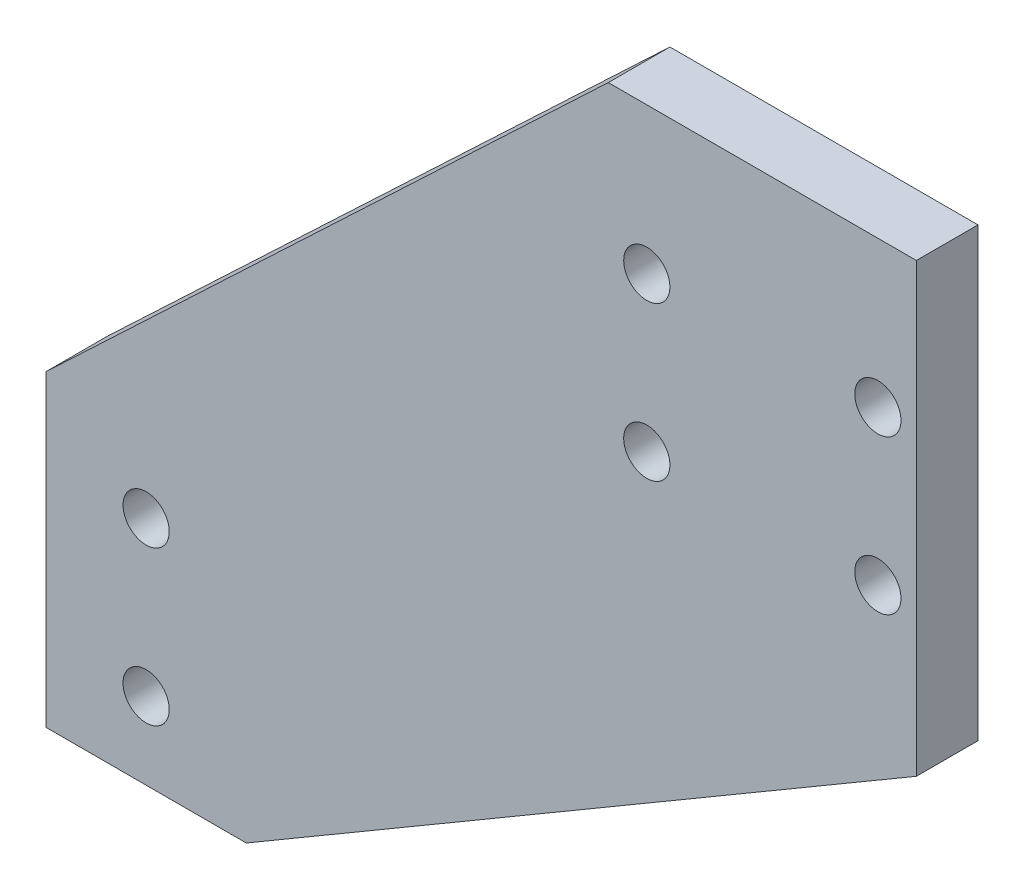
from build123d import *

# Parameters (mm, degrees)
SKETCH_1_R      = 1.5
EXTRUDE_1_DEPTH = 4


with BuildPart() as part:
    # 草图1 → 凸台-拉伸1 (new body)
    with BuildSketch(Plane.XY):
        Polygon((0, 0), (13, 0), (56.5, 25.5), (56.5, 54.5), (36.5, 54.5), (0, 20), align=None)
        with Locations((6.5, 15)):
            Circle(SKETCH_1_R, mode=Mode.SUBTRACT)
        with Locations(Location((6.5, 5, 0), (0, 0, 180))):
            Circle(SKETCH_1_R, mode=Mode.SUBTRACT)
        with Locations((39, 35)):
            Circle(SKETCH_1_R, mode=Mode.SUBTRACT)
        with Locations(Location((54, 35, 0), (0, 0, 180))):
            Circle(SKETCH_1_R, mode=Mode.SUBTRACT)
        with Locations(Location((39, 45, 0), (0, 0, 180))):
            Circle(SKETCH_1_R, mode=Mode.SUBTRACT)
        with Locations((54, 45)):
            Circle(SKETCH_1_R, mode=Mode.SUBTRACT)
    extrude(amount=EXTRUDE_1_DEPTH)


solid = part.part
